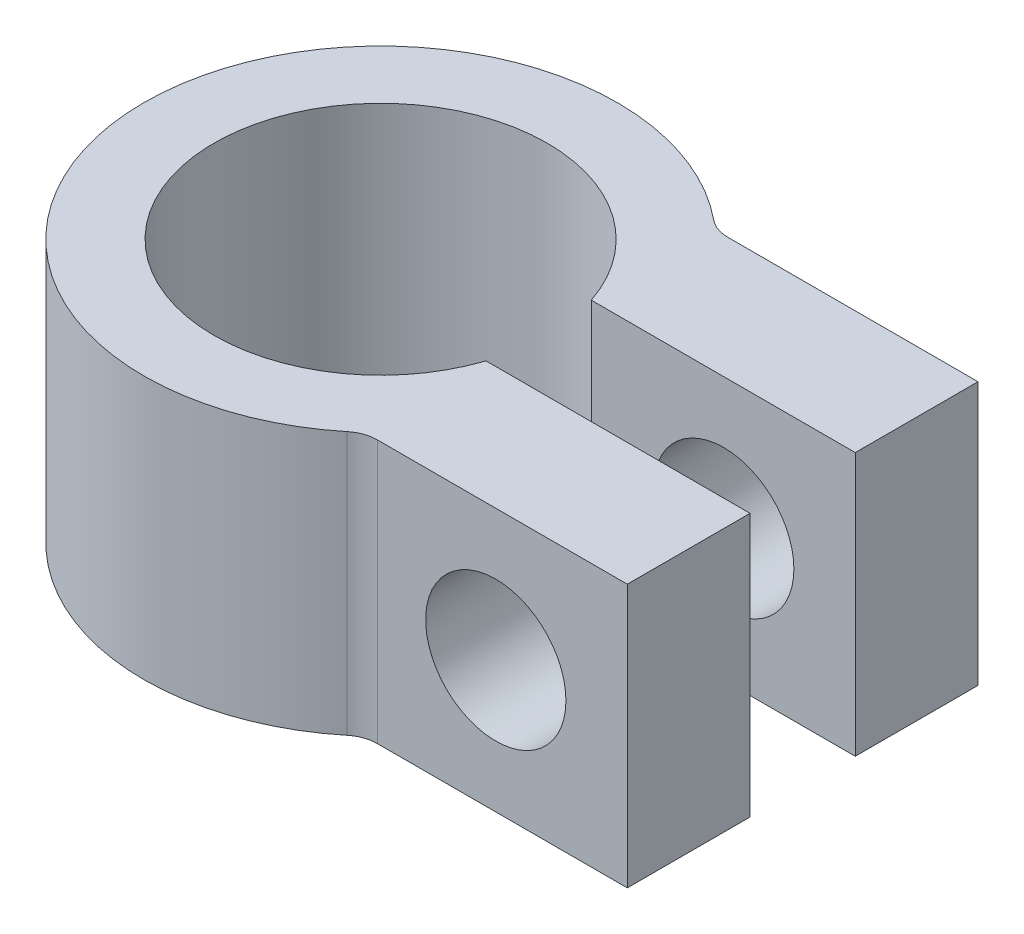
from build123d import *

# Parameters (mm, degrees)
SCHIZZO3_R           = 13.5
SCHIZZO3_R_2         = 9.5
ANELLO_DEPTH         = 15
AGGANCIOALTO_DEPTH   = 15
SCHIZZO5_W           = 24.069178574
SCHIZZO5_H           = 6
APERTURAANELLO_DEPTH = 32.409797153
SCHIZZO6_R           = 4
FOROPASSANTE_DEPTH   = 37.831716729
RACCORDOBASSO_R      = 2
RACCORDOALTO_R       = 2


with BuildPart() as part:
    # Schizzo3 → Anello (new body)
    with BuildSketch(Plane(origin=(0, 0, 0), x_dir=(1, 0, 0), z_dir=(0, 1, 0))):
        with Locations(Location((0, 0, 0), (0, 0, 270))):
            Circle(SCHIZZO3_R)
        with Locations(Location((0, 0, 0), (0, 0, 270))):
            Circle(SCHIZZO3_R_2, mode=Mode.SUBTRACT)
    extrude(amount=ANELLO_DEPTH)

    # Schizzo4 → AggancioAlto (add)
    with BuildSketch(Plane(origin=(0, 0, 0), x_dir=(1, 0, 0), z_dir=(0, 1, 0))):
        with BuildLine():
            Line((24.069178574, 3), (13.162446581, 3))
            ThreePointArc((13.162446581, 3), (11.653810075, 6.814595421), (9.069178574, 10))
            Line((9.069178574, 10), (24.069178574, 10))
            Line((24.069178574, 10), (24.069178574, 3))
        make_face()
    aggancioalto = extrude(amount=AGGANCIOALTO_DEPTH)

    # AggancioBasso: AggancioAlto across plane
    add(aggancioalto.mirror(Plane.XY))

    # Schizzo5 → AperturaAnello (cut, through all)
    with BuildSketch(Plane(origin=(0, 15, 0), x_dir=(1, 0, 0), z_dir=(0, 1, 0))):
        with Locations((12.034589287, 0)):
            Rectangle(SCHIZZO5_W, SCHIZZO5_H)
    extrude(amount=-APERTURAANELLO_DEPTH, mode=Mode.SUBTRACT)

    # Schizzo6 → ForoPassante (cut, through all)
    with BuildSketch(Plane.XY.offset(10)):
        with Locations((16.569178574, 7.5)):
            Circle(SCHIZZO6_R)
    extrude(amount=-FOROPASSANTE_DEPTH, mode=Mode.SUBTRACT)

    # RaccordoBasso
    raccordobasso_edges = [part.edges().sort_by_distance(p)[0] for p in [
        (9.069178574, 7.5, 10),
    ]]
    fillet(raccordobasso_edges, radius=RACCORDOBASSO_R)

    # RaccordoAlto
    raccordoalto_edges = [part.edges().sort_by_distance(p)[0] for p in [
        (9.069178574, 7.5, -10),
    ]]
    fillet(raccordoalto_edges, radius=RACCORDOALTO_R)


solid = part.part
